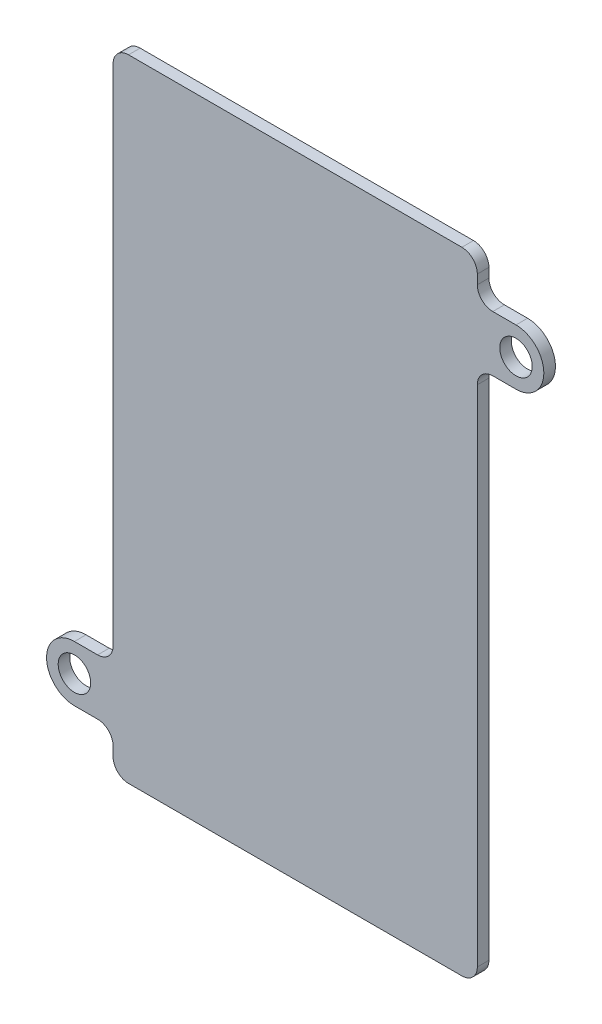
from build123d import *

# Parameters (mm, degrees)
SKETCH1_R           = 2.1
BOSS_EXTRUDE1_DEPTH = 1.5
FILLET1_R           = 2


with BuildPart() as part:
    # Sketch1 → Boss-Extrude1 (new body)
    with BuildSketch(Plane(origin=(0, 0, 0), x_dir=(-1, 0, 0), z_dir=(0, 0, -1))):
        with BuildLine():
            Line((-23.55, 40.8), (-23.55, 35.6))
            Line((-23.55, 35.6), (-28.55, 35.6))
            ThreePointArc((-28.55, 35.6), (-32.15, 32), (-28.55, 28.4))
            Line((-28.55, 28.4), (-23.55, 28.4))
            Line((-23.55, 28.4), (-23.55, -40.8))
            Line((-23.55, -40.8), (23.55, -40.8))
            Line((23.55, -40.8), (23.55, -35.6))
            Line((23.55, -35.6), (28.55, -35.6))
            ThreePointArc((28.55, -35.6), (32.15, -32), (28.55, -28.4))
            Line((28.55, -28.4), (23.55, -28.4))
            Line((23.55, -28.4), (23.55, 40.8))
            Line((23.55, 40.8), (-23.55, 40.8))
        make_face()
        with Locations(Location((-28.55, 32, 0), (0, 0, 180))):
            Circle(SKETCH1_R, mode=Mode.SUBTRACT)
        with Locations((28.55, -32)):
            Circle(SKETCH1_R, mode=Mode.SUBTRACT)
    extrude(amount=BOSS_EXTRUDE1_DEPTH)

    # Fillet1
    fillet1_edges = [part.edges().sort_by_distance(p)[0] for p in [
        (23.55, 40.8, -0.75),
        (23.55, 35.6, -0.75),
        (23.55, 28.4, -0.75),
        (23.55, -40.8, -0.75),
        (-23.55, -40.8, -0.75),
        (-23.55, -35.6, -0.75),
        (-23.55, -28.4, -0.75),
        (-23.55, 40.8, -0.75),
    ]]
    fillet(fillet1_edges, radius=FILLET1_R)


solid = part.part
